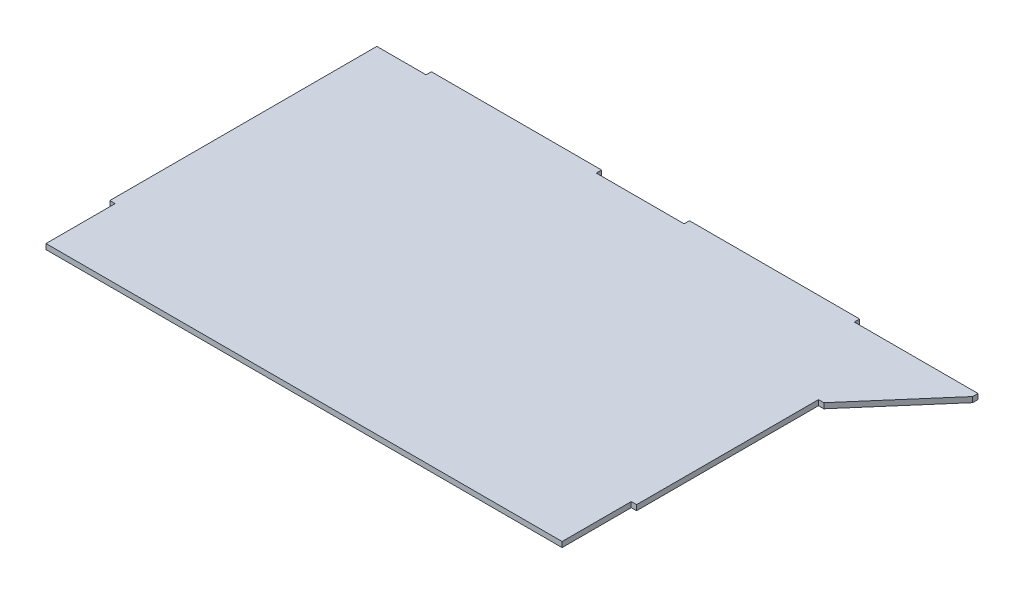
from build123d import *

# Parameters (mm, degrees)
SKETCH1_W           = 314.43168
SKETCH1_H           = 3.175
BOSS_EXTRUDE1_DEPTH = 200.66180012
CUT_EXTRUDE2_START  = -3.175
SKETCH5_W           = 3.175
SKETCH5_H           = 41.275
CUT_EXTRUDE2_DEPTH  = 259.11040162
BOSS_EXTRUDE3_DEPTH = 3.175
SKETCH12_W          = 101.6
SKETCH12_H          = 3.175
BOSS_EXTRUDE5_DEPTH = 3.175


with BuildPart() as part:
    # Sketch1 → Boss-Extrude1 (new body)
    with BuildSketch(Plane.XY):
        Rectangle(SKETCH1_W, SKETCH1_H)
    extrude(amount=BOSS_EXTRUDE1_DEPTH)

    # Sketch5 → Cut-Extrude2 (cut)
    with BuildSketch(Plane(origin=(0, 1.5875, 0), x_dir=(1, 0, 0), z_dir=(0, 1, 0)).offset(CUT_EXTRUDE2_START)):
        with Locations((-155.62834, -180.02430012)):
            Rectangle(SKETCH5_W, SKETCH5_H)
    cut_extrude2 = extrude(amount=CUT_EXTRUDE2_DEPTH, mode=Mode.SUBTRACT)

    # Mirror1: Cut-Extrude2 across plane
    add(cut_extrude2.mirror(Plane(origin=(0, 0, 0), x_dir=(0, 0, 1), z_dir=(1, 0, 0))), mode=Mode.SUBTRACT)

    # Sketch10 → Boss-Extrude3 (add)
    with BuildSketch(Plane.XZ.offset(1.5875)):
        Polygon((201.6506, 0), (201.6506, 3.175), (160.39084, 50.8), (157.21584, 50.8), (157.21584, 0), align=None)
    extrude(amount=-BOSS_EXTRUDE3_DEPTH)

    # Sketch12 → Boss-Extrude5 (add)
    with BuildSketch(Plane(origin=(0, 0, 0), x_dir=(-1, 0, 0), z_dir=(0, 0, -1))):
        with Locations((-77.02050001, 0)):
            Rectangle(SKETCH12_W, SKETCH12_H)
    boss_extrude5 = extrude(amount=BOSS_EXTRUDE5_DEPTH)

    # Mirror2: Boss-Extrude5 across plane
    add(boss_extrude5.mirror(Plane(origin=(0, 0, 0), x_dir=(0, 0, 1), z_dir=(1, 0, 0))))


solid = part.part
